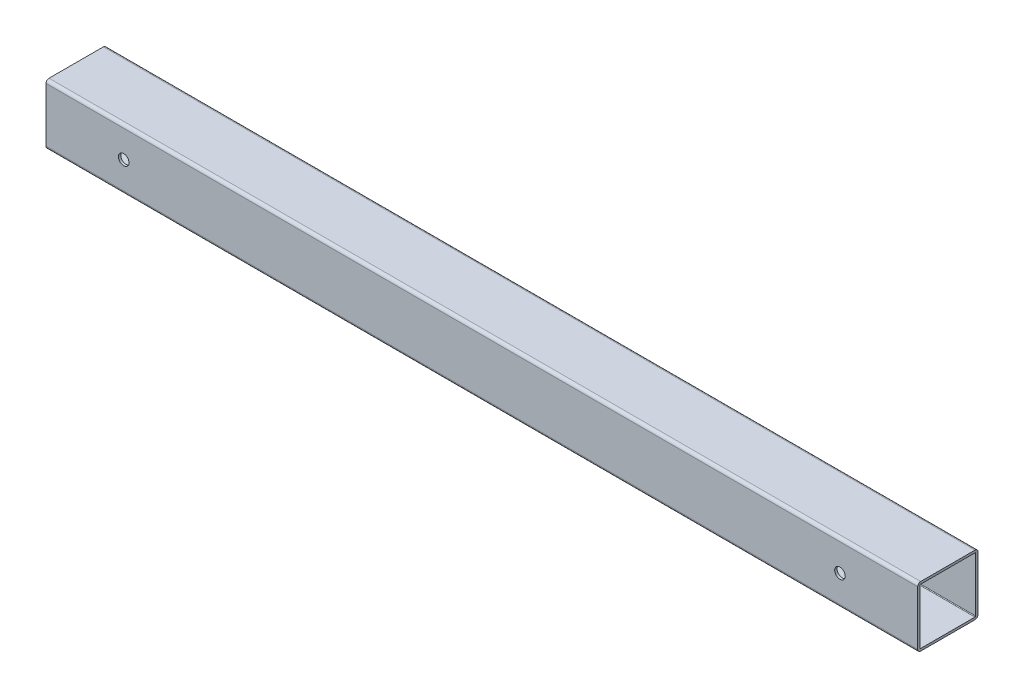
from build123d import *

# Parameters (mm, degrees)
C_USERS_RAULSTAR_MEU_DRIVE_TEMPLATES_BIB_DEPTH = 578.0536
CORTE_EXTRUS_O1_DEPTH                          = 293.466222183
CORTE_EXTRUS_O1_DEPTH_BACK                     = 293.466222183
ESBO_O4_R                                      = 3.5


with BuildPart() as part:
    # Esboço1 → C_USERS_RAULSTAR_MEU DRIVE_TEMPLATES_BIB (new body)
    with BuildSketch(Plane.YZ.offset(-289.0268)):
        with BuildLine():
            Line((-18, -20), (18, -20))
            ThreePointArc((18, -20), (19.414213562, -19.414213562), (20, -18))
            Line((20, -18), (20, 18))
            ThreePointArc((20, 18), (19.414213562, 19.414213562), (18, 20))
            Line((18, 20), (-18, 20))
            ThreePointArc((-18, 20), (-19.414213562, 19.414213562), (-20, 18))
            Line((-20, 18), (-20, -18))
            ThreePointArc((-20, -18), (-19.414213562, -19.414213562), (-18, -20))
        make_face()
        with BuildLine():
            Line((-18, -18.45), (18, -18.45))
            ThreePointArc((18, -18.45), (18.318198052, -18.318198052), (18.45, -18))
            Line((18.45, -18), (18.45, 18))
            ThreePointArc((18.45, 18), (18.318198052, 18.318198052), (18, 18.45))
            Line((18, 18.45), (-18, 18.45))
            ThreePointArc((-18, 18.45), (-18.318198052, 18.318198052), (-18.45, 18))
            Line((-18.45, 18), (-18.45, -18))
            ThreePointArc((-18.45, -18), (-18.318198052, -18.318198052), (-18, -18.45))
        make_face(mode=Mode.SUBTRACT)
    extrude(amount=C_USERS_RAULSTAR_MEU_DRIVE_TEMPLATES_BIB_DEPTH)

    # Esboço4 → Corte-extrusão1 (cut, two sides: drawn at the far end of the back side and taken through both)
    with BuildSketch(Plane(origin=(0, 0, -20), x_dir=(-1, 0, 0), z_dir=(0, 0, -1)).offset(-CORTE_EXTRUS_O1_DEPTH_BACK)):
        with Locations(Location((-237.5, 0, 0), (0, 0, 270))):
            Circle(ESBO_O4_R)
        with Locations(Location((237.5, 0, 0), (0, 0, 270))):
            Circle(ESBO_O4_R)
        with Locations((-237.5, -515.772820858)):
            Circle(ESBO_O4_R)
        with Locations((237.5, -515.772820858)):
            Circle(ESBO_O4_R)
    extrude(amount=CORTE_EXTRUS_O1_DEPTH + CORTE_EXTRUS_O1_DEPTH_BACK, mode=Mode.SUBTRACT)


solid = part.part
